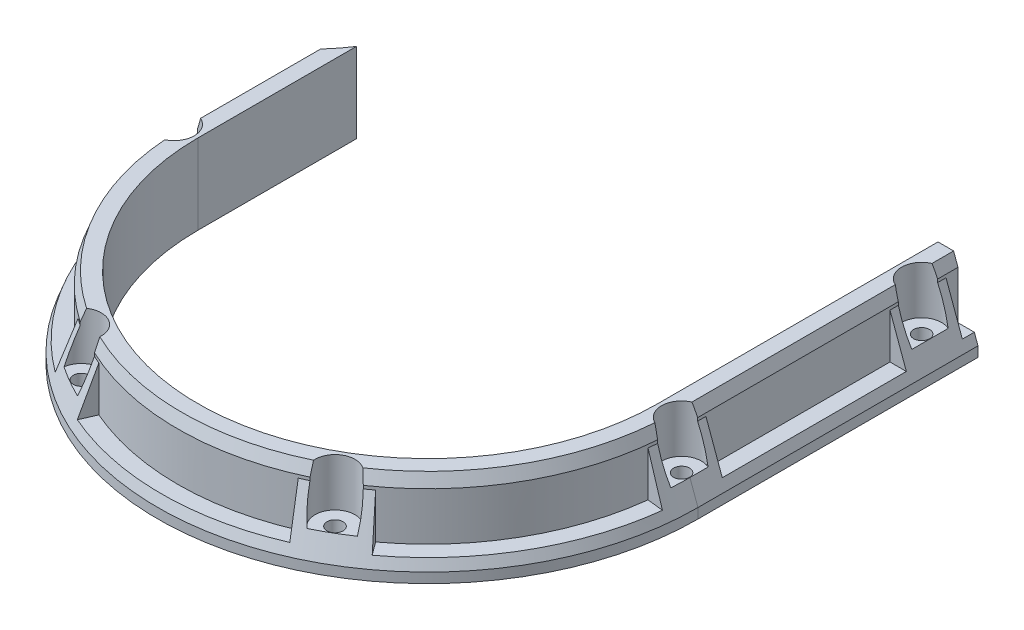
from build123d import *
from OCP.BRepFilletAPI import BRepFilletAPI_MakeChamfer

# Parameters (mm, degrees)
BOSS_EXTRUDE1_DEPTH     = 25.4
BOSS_EXTRUDE2_DEPTH     = 6.35
CHAMFER1_SIZE           = 3.175
CHAMFER1_SIZE2          = 1.155605494
BOSS_EXTRUDE3_DEPTH     = 8.89
REVOLVE1_ANGLE          = 6.5
CHAMFER2_SIZE           = 3.81
CHAMFER2_SIZE2          = 1.386726593
CIRPATTERN1_COUNT       = 3
CIRPATTERN1_ANGLE       = 120
LPATTERN1_COUNT         = 2
LPATTERN1_PITCH         = 76.2
CUT_EXTRUDE1_DEPTH      = 258.62068172
CUT_EXTRUDE1_DEPTH_BACK = 258.62068172
SKETCH8_R               = 2.54
SKETCH8_3_R             = 6.35
CUT_EXTRUDE2_DEPTH      = 15.24


with BuildPart() as part:
    # Sketch2 → Boss-Extrude1 (new body)
    with BuildSketch(Plane(origin=(0, 0, 0), x_dir=(1, 0, 0), z_dir=(0, 1, 0))):
        with BuildLine():
            Line((186.055, 0), (186.055, -76.2))
            ThreePointArc((186.055, -76.2), (113.03, -149.225), (40.005, -76.2))
            Line((40.005, -76.2), (40.005, -25.840677236))
            ThreePointArc((40.005, -25.840677236), (37.038884837, -29.937629082), (33.655, -33.69690787))
            Line((33.655, -33.69690787), (33.655, -76.2))
            ThreePointArc((33.655, -76.2), (113.03, -155.575), (192.405, -76.2))
            Line((192.405, -76.2), (192.405, 12.7))
            Line((192.405, 12.7), (186.055, 12.7))
            Line((186.055, 12.7), (186.055, 0))
        make_face()
    extrude(amount=BOSS_EXTRUDE1_DEPTH)

    # Sketch2<3> → Boss-Extrude2 (add)
    with BuildSketch(Plane(origin=(0, 0, 0), x_dir=(1, 0, 0), z_dir=(0, 1, 0))):
        with BuildLine():
            Line((198.755, 12.7), (192.405, 12.7))
            Line((192.405, 12.7), (192.405, -76.2))
            ThreePointArc((192.405, -76.2), (113.03, -155.575), (33.655, -76.2))
            Line((33.655, -76.2), (33.655, -33.69690787))
            ThreePointArc((33.655, -33.69690787), (30.595993432, -36.496928788), (27.305, -39.020220399))
            Line((27.305, -39.020220399), (27.305, -76.2))
            ThreePointArc((27.305, -76.2), (113.03, -161.925), (198.755, -76.2))
            Line((198.755, -76.2), (198.755, 12.7))
        make_face()
    extrude(amount=BOSS_EXTRUDE2_DEPTH)

    # Chamfer1: one chamfer whose edges measure the first distance from different faces: ONE call of the kernel's chamfer builder (chamfer() names one face for all edges)
    chamfer1_edges_1 = [part.edges().sort_by_distance(p)[0] for p in [
        (27.305, 6.35, 57.6101102),
    ]]
    chamfer1_side_1 = [part.faces().sort_by_distance(p)[0] for p in [
        (27.305, 3.175, 57.6101102),
    ]]
    chamfer1_edges_2 = [part.edges().sort_by_distance(p)[0] for p in [
        (198.755, 6.35, 31.75),
    ]]
    chamfer1_side_2 = [part.faces().sort_by_distance(p)[0] for p in [
        (198.755, 3.175, 31.75),
    ]]
    chamfer1_edges_3 = [part.edges().sort_by_distance(p)[0] for p in [
        (113.03, 6.35, 161.925),
    ]]
    chamfer1_side_3 = [part.faces().sort_by_distance(p)[0] for p in [
        (113.03, 3.175, 161.925),
    ]]
    chamfer1 = BRepFilletAPI_MakeChamfer(part.part.solid().wrapped)
    for e in chamfer1_edges_1:
        chamfer1.Add(CHAMFER1_SIZE, CHAMFER1_SIZE2, e.wrapped, chamfer1_side_1[0].wrapped)  # the first distance lies on this face
    for e in chamfer1_edges_2:
        chamfer1.Add(CHAMFER1_SIZE, CHAMFER1_SIZE2, e.wrapped, chamfer1_side_2[0].wrapped)  # the first distance lies on this face
    for e in chamfer1_edges_3:
        chamfer1.Add(CHAMFER1_SIZE, CHAMFER1_SIZE2, e.wrapped, chamfer1_side_3[0].wrapped)  # the first distance lies on this face
    add(Compound.cast(chamfer1.Shape()), mode=Mode.REPLACE)

    # Chamfer2: one chamfer whose edges measure the first distance from different faces: ONE call of the kernel's chamfer builder (chamfer() names one face for all edges)
    chamfer2_edges_1 = [part.edges().sort_by_distance(p)[0] for p in [
        (33.655, 25.4, 54.948453935),
    ]]
    chamfer2_side_1 = [part.faces().sort_by_distance(p)[0] for p in [
        (33.655, 15.875, 54.948453935),
    ]]
    chamfer2_edges_2 = [part.edges().sort_by_distance(p)[0] for p in [
        (192.405, 25.4, 31.75),
    ]]
    chamfer2_side_2 = [part.faces().sort_by_distance(p)[0] for p in [
        (192.405, 15.875, 31.75),
    ]]
    chamfer2_edges_3 = [part.edges().sort_by_distance(p)[0] for p in [
        (113.03, 25.4, 155.575),
    ]]
    chamfer2_side_3 = [part.faces().sort_by_distance(p)[0] for p in [
        (113.03, 15.875, 155.575),
    ]]
    chamfer2 = BRepFilletAPI_MakeChamfer(part.part.solid().wrapped)
    for e in chamfer2_edges_1:
        chamfer2.Add(CHAMFER2_SIZE, CHAMFER2_SIZE2, e.wrapped, chamfer2_side_1[0].wrapped)  # the first distance lies on this face
    for e in chamfer2_edges_2:
        chamfer2.Add(CHAMFER2_SIZE, CHAMFER2_SIZE2, e.wrapped, chamfer2_side_2[0].wrapped)  # the first distance lies on this face
    for e in chamfer2_edges_3:
        chamfer2.Add(CHAMFER2_SIZE, CHAMFER2_SIZE2, e.wrapped, chamfer2_side_3[0].wrapped)  # the first distance lies on this face
    add(Compound.cast(chamfer2.Shape()), mode=Mode.REPLACE)


with BuildPart() as body_2:
    # Sketch4 → Boss-Extrude3 (new body)
    with BuildSketch(Plane.XY.offset(76.2)):
        Polygon((28.460605494, 6.35), (33.655, 20.621481614), (33.655, 6.35), align=None)
    extrude(amount=-BOSS_EXTRUDE3_DEPTH)


with BuildPart() as body_3:
    # Sketch4<4> → Revolve1 (revolve)
    with BuildSketch(Plane.XY.offset(76.2)):
        Polygon((28.460605494, 6.35), (33.655, 20.621481614), (33.655, 6.35), align=None)
    revolve(axis=Axis((113.03, 0, 76.2), (0, 1, 0)), revolution_arc=REVOLVE1_ANGLE)


with BuildPart() as body_4:
    # Mirror1: mirrored copy
    add(body_3.part.mirror(Plane.ZY.offset(-113.03)))


with BuildPart() as body_5:
    # Mirror1 2: mirrored copy
    add(body_2.part.mirror(Plane.ZY.offset(-113.03)))


with BuildPart() as cirpattern1_1:
    # CirPattern1: pattern copy
    add(body_3.part.rotate(Axis((113.03, 0, 76.2), (0, 1, 0)), 1 * CIRPATTERN1_ANGLE / (CIRPATTERN1_COUNT - 1)))


with BuildPart() as cirpattern1_2:
    # CirPattern1: pattern copy
    add(body_3.part.rotate(Axis((113.03, 0, 76.2), (0, 1, 0)), 2 * CIRPATTERN1_ANGLE / (CIRPATTERN1_COUNT - 1)))


with BuildPart() as body_8:
    # Mirror2: mirrored copy
    add(cirpattern1_1.part.mirror(Plane(origin=(56.515, 0, 174.08685139), x_dir=(-0.499999999999998, 0, 0.8660254037844398), z_dir=(0.8660254037844398, 0, 0.499999999999998))))


with BuildPart() as body_9:
    # Mirror3: mirrored copy
    add(cirpattern1_2.part.mirror(Plane(origin=(169.545, 0, 174.08685139), x_dir=(0.5000000000000039, 0, 0.8660254037844363), z_dir=(0.8660254037844363, 0, -0.500000000000004))))


with BuildPart() as lpattern1_1:
    # LPattern1: pattern copy
    add(body_5.part.moved(Location(Vector(0, 0, -1) * (1 * LPATTERN1_PITCH))))


with BuildPart() as body_11:
    # Mirror4: mirrored copy
    add(lpattern1_1.part.mirror(Plane(origin=(226.06, 0, 0), x_dir=(1, 0, 0), z_dir=(0, 0, -1))))


with BuildPart() as body_4_1:
    add(body_4.part)

    # Combine2: union body 8, body 11, body 5, CirPattern1_1, CirPattern1_2, part, body 9, body 2, LPattern1_1, body 3
    add(body_8.part)
    add(body_11.part)
    add(body_5.part)
    add(cirpattern1_1.part)
    add(cirpattern1_2.part)
    add(part.part)
    add(body_9.part)
    add(body_2.part)
    add(lpattern1_1.part)
    add(body_3.part)

    # Sketch8 → Cut-Extrude1 (cut, two sides: drawn at the far end of the back side and taken through both)
    with BuildSketch(Plane(origin=(0, 25.4, 0), x_dir=(1, 0, 0), z_dir=(0, 1, 0)).offset(-CUT_EXTRUDE1_DEPTH_BACK)):
        with Locations((32.501726593, -76.2)):
            Circle(SKETCH8_R)
        with Locations((72.765863296, -145.939530494)):
            Circle(SKETCH8_R)
        with Locations((153.294136704, -145.939530494)):
            Circle(SKETCH8_R)
        with Locations((193.558273407, -76.2)):
            Circle(SKETCH8_R)
        with Locations((193.558273407, 0)):
            Circle(SKETCH8_R)
    extrude(amount=CUT_EXTRUDE1_DEPTH + CUT_EXTRUDE1_DEPTH_BACK, mode=Mode.SUBTRACT)

    # Sketch8<3> → Cut-Extrude2 (cut)
    with BuildSketch(Plane(origin=(0, 25.4, 0), x_dir=(1, 0, 0), z_dir=(0, 1, 0))):
        with Locations((32.501726593, -76.2)):
            Circle(SKETCH8_3_R)
        with Locations((72.765863296, -145.939530494)):
            Circle(SKETCH8_3_R)
        with Locations((153.294136704, -145.939530494)):
            Circle(SKETCH8_3_R)
        with Locations((193.558273407, -76.2)):
            Circle(SKETCH8_3_R)
        with Locations((193.558273407, 0)):
            Circle(SKETCH8_3_R)
    extrude(amount=-CUT_EXTRUDE2_DEPTH, mode=Mode.SUBTRACT)


solid = body_4_1.part
